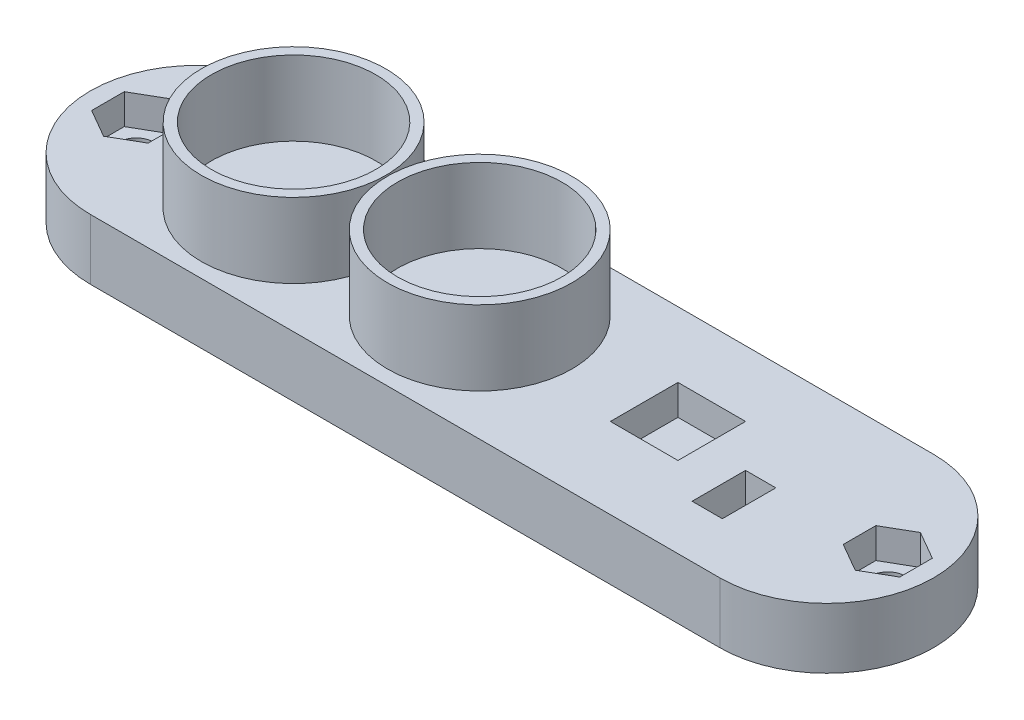
from build123d import *

# Parameters (mm, degrees)
BOSS_EXTRUDE1_DEPTH = 6
SKETCH2_R           = 9.15
SKETCH2_R_2         = 8.15
BOSS_EXTRUDE2_DEPTH = 7.4
CUT_EXTRUDE1_DEPTH  = 3
SKETCH4_R           = 1.75
CUT_EXTRUDE2_DEPTH  = 45.359440934
SKETCH5_W           = 3
SKETCH5_H           = 5.3
SKETCH5_W_2         = 6.7
SKETCH5_H_2         = 6.7
CUT_EXTRUDE3_DEPTH  = 3


with BuildPart() as part:
    # Sketch1 → Boss-Extrude1 (new body)
    with BuildSketch(Plane(origin=(0, 0, 0), x_dir=(1, 0, 0), z_dir=(0, 1, 0))):
        with BuildLine():
            Line((-31.2, 10.6), (31.2, 10.6))
            ThreePointArc((31.2, 10.6), (41.8, 0), (31.2, -10.6))
            Line((31.2, -10.6), (-31.2, -10.6))
            ThreePointArc((-31.2, -10.6), (-41.8, 0), (-31.2, 10.6))
        make_face()
    extrude(amount=BOSS_EXTRUDE1_DEPTH)

    # Sketch2 → Boss-Extrude2 (add)
    # profile 1 of 2: a face of its own
    with BuildSketch(Plane(origin=(0, 6, 0), x_dir=(1, 0, 0), z_dir=(0, 1, 0))):
        with Locations(Location((-21.65, 0, 0), (0, 0, 270))):
            Circle(SKETCH2_R)
        with Locations(Location((-21.65, 0, 0), (0, 0, 270))):
            Circle(SKETCH2_R_2, mode=Mode.SUBTRACT)
    # profile 2 of 2: a face of its own
    with BuildSketch(Plane(origin=(0, 6, 0), x_dir=(1, 0, 0), z_dir=(0, 1, 0))):
        with Locations(Location((-3.2, 0, 0), (0, 0, 270))):
            Circle(SKETCH2_R)
        with Locations(Location((-3.2, 0, 0), (0, 0, 270))):
            Circle(SKETCH2_R_2, mode=Mode.SUBTRACT)
    extrude(amount=BOSS_EXTRUDE2_DEPTH)

    # Sketch3 → Cut-Extrude1 (cut)
    with BuildSketch(Plane(origin=(0, 6, 0), x_dir=(1, 0, 0), z_dir=(0, 1, 0))):
        Polygon((-37.25, -3.233161507), (-34.45, -1.616580754), (-34.45, 1.616580754), (-37.25, 3.233161507), (-40.05, 1.616580754), (-40.05, -1.616580754), align=None)
        Polygon((37.25, -3.233161507), (40.05, -1.616580754), (40.05, 1.616580754), (37.25, 3.233161507), (34.45, 1.616580754), (34.45, -1.616580754), align=None)
    extrude(amount=-CUT_EXTRUDE1_DEPTH, mode=Mode.SUBTRACT)

    # Sketch4 → Cut-Extrude2 (cut, through all)
    with BuildSketch(Plane(origin=(0, 3, 0), x_dir=(1, 0, 0), z_dir=(0, 1, 0))):
        with Locations(Location((-37.25, 0, 0), (0, 0, 270))):
            Circle(SKETCH4_R)
        with Locations(Location((37.25, 0, 0), (0, 0, 270))):
            Circle(SKETCH4_R)
    extrude(amount=-CUT_EXTRUDE2_DEPTH, mode=Mode.SUBTRACT)

    # Sketch5 → Cut-Extrude3 (cut)
    with BuildSketch(Plane(origin=(0, 6, 0), x_dir=(1, 0, 0), z_dir=(0, 1, 0))):
        with Locations((24.75, -2.75)):
            Rectangle(SKETCH5_W, SKETCH5_H)
        with Locations((15.7, 0.75)):
            Rectangle(SKETCH5_W_2, SKETCH5_H_2)
    extrude(amount=-CUT_EXTRUDE3_DEPTH, mode=Mode.SUBTRACT)


solid = part.part
